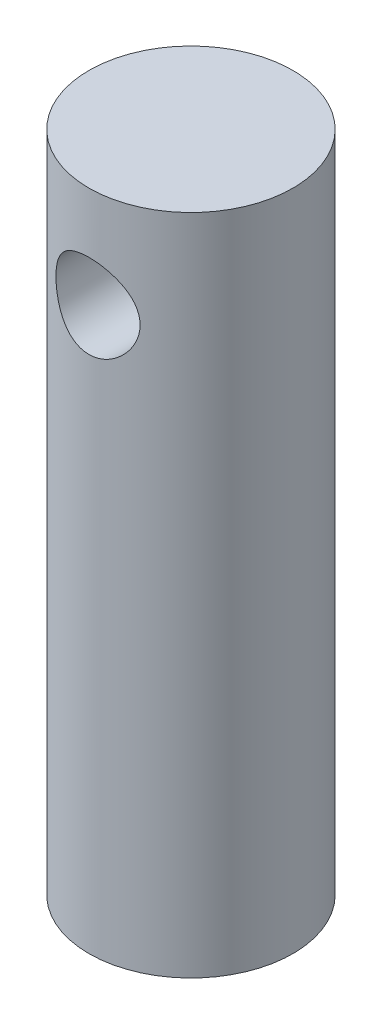
from build123d import *

# Parameters (mm, degrees)
SKETCH1_R               = 4
BOSS_EXTRUDE1_DEPTH     = 26
CUT_EXTRUDE1_DEPTH      = 27.608269391
CUT_EXTRUDE1_DEPTH_BACK = 27.608269391
SKETCH2_R               = 1.65


with BuildPart() as part:
    # Sketch1 → Boss-Extrude1 (new body)
    with BuildSketch(Plane(origin=(0, 0, 0), x_dir=(1, 0, 0), z_dir=(0, 1, 0))):
        with Locations(Location((0, 0, 0), (0, 0, 90))):
            Circle(SKETCH1_R)
    extrude(amount=BOSS_EXTRUDE1_DEPTH)

    # Sketch2 → Cut-Extrude1 (cut, two sides: drawn at the far end of the back side and taken through both)
    with BuildSketch(Plane.XY.offset(-CUT_EXTRUDE1_DEPTH_BACK)):
        with Locations(Location((0, 22, 0), (0, 0, 90))):
            Circle(SKETCH2_R)
    extrude(amount=CUT_EXTRUDE1_DEPTH + CUT_EXTRUDE1_DEPTH_BACK, mode=Mode.SUBTRACT)


solid = part.part
